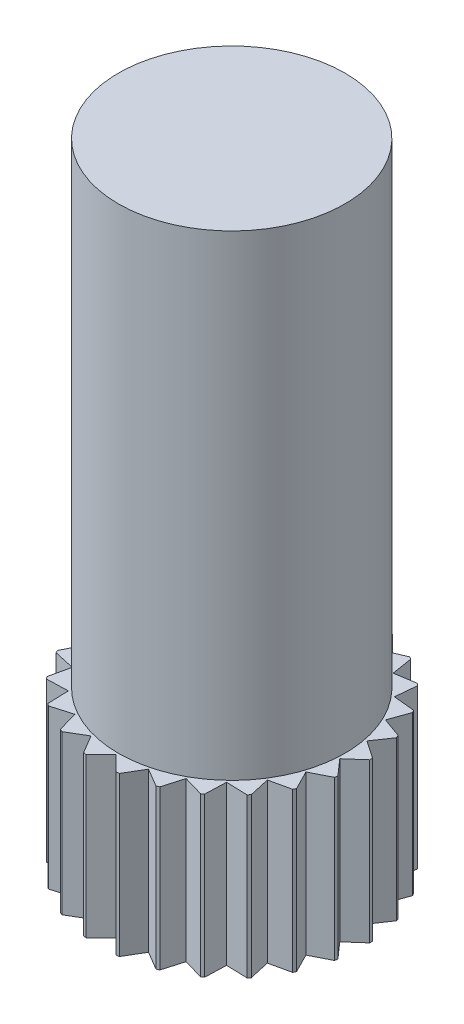
from build123d import *

# Parameters (mm, degrees)
SKETCH_1_R                   = 2.9
EXTRUDE_1_DEPTH              = 3.5
SKETCH_2_R                   = 2.5
EXTRUDE_2_DEPTH              = 10.5
CUT_EXTRUDE_1_DEPTH          = 3.5
HOLE_WIZARD_M3_1_D           = 2.5
HOLE_WIZARD_M3_1_DEPTH       = 8
HOLE_WIZARD_M3_1_CSINK_D     = 3.2
HOLE_WIZARD_M3_1_CSINK_ANGLE = 90
HOLE_WIZARD_M3_1_TIP         = 1.25


with BuildPart() as part:
    # 草图1 → 凸台-拉伸1 (new body)
    with BuildSketch(Plane(origin=(0, 0, 0), x_dir=(1, 0, 0), z_dir=(0, 1, 0))):
        with Locations(Location((0, 0, 0), (0, 0, 270))):
            Circle(SKETCH_1_R)
    extrude(amount=EXTRUDE_1_DEPTH)

    # 草图2 → 凸台-拉伸2 (add)
    with BuildSketch(Plane(origin=(0, 3.5, 0), x_dir=(1, 0, 0), z_dir=(0, 1, 0))):
        with Locations(Location((0, 0, 0), (0, 0, 90))):
            Circle(SKETCH_2_R)
    extrude(amount=EXTRUDE_2_DEPTH)

    # 草图3 → 切除-拉伸1 (cut)
    with BuildSketch(Plane.XZ):
        Polygon((0, 2.55), (0.366495157, 2.916495157), (-0.366495157, 2.916495157), align=None)
        Polygon((0.634159212, 2.469887061), (1.080283889, 2.733724459), (0.370321814, 2.916011738), align=None)
        Polygon((1.228471869, 2.234582034), (1.726194412, 2.3791838), (1.083870103, 2.732304577), align=None)
        Polygon((1.74559512, 1.85887), (2.263641791, 1.875150272), (1.729314848, 2.37691667), align=None)
        Polygon((2.15303621, 1.366358327), (2.658856231, 1.253294157), (2.26610038, 1.872178348), align=None)
        Polygon((2.425194117, 0.787993336), (2.887004956, 0.55268896), (2.660498492, 1.249804175), align=None)
        Polygon((2.544968157, 0.160115825), (2.933752541, -0.182643716), (2.887727699, 0.548900209), align=None)
        Polygon((2.504832489, -0.477822352), (2.796161665, -0.906500217), (2.933510354, -0.186493176), align=None)
        Polygon((2.307308984, -1.085737193), (2.482877668, -1.573397974), (2.794969765, -0.910168509), align=None)
        Polygon((1.964808769, -1.625431174), (2.013585336, -2.141433351), (2.480810946, -1.576654607), align=None)
        Polygon((1.498852393, -2.062993336), (1.417772031, -2.574914594), (2.010773652, -2.144073698), align=None)
        Polygon((0.938717609, -2.370930039), (0.732874896, -2.846604484), (1.414392054, -2.576772752), align=None)
        Polygon((0.319599746, -2.529892488), (0.001928536, -2.939431745), (0.729139002, -2.847563698), align=None)
        Polygon((-0.319599746, -2.529892488), (-0.729139002, -2.847563698), (-0.001928536, -2.939431745), align=None)
        Polygon((-0.938717609, -2.370930039), (-1.414392054, -2.576772752), (-0.732874896, -2.846604484), align=None)
        Polygon((-1.498852393, -2.062993336), (-2.010773652, -2.144073698), (-1.417772031, -2.574914594), align=None)
        Polygon((-1.964808769, -1.625431174), (-2.480810946, -1.576654607), (-2.013585336, -2.141433351), align=None)
        Polygon((-2.307308984, -1.085737193), (-2.794969765, -0.910168509), (-2.482877668, -1.573397974), align=None)
        Polygon((-2.504832489, -0.477822352), (-2.933510354, -0.186493176), (-2.796161665, -0.906500217), align=None)
        Polygon((-2.544968157, 0.160115825), (-2.887727699, 0.548900209), (-2.933752541, -0.182643716), align=None)
        Polygon((-2.425194117, 0.787993336), (-2.660498492, 1.249804175), (-2.887004956, 0.55268896), align=None)
        Polygon((-2.15303621, 1.366358327), (-2.26610038, 1.872178348), (-2.658856231, 1.253294157), align=None)
        Polygon((-1.74559512, 1.85887), (-1.729314848, 2.37691667), (-2.263641791, 1.875150272), align=None)
        Polygon((-1.228471869, 2.234582034), (-1.083870103, 2.732304577), (-1.726194412, 2.3791838), align=None)
        Polygon((-0.634159212, 2.469887061), (-0.370321814, 2.916011738), (-1.080283889, 2.733724459), align=None)
    extrude(amount=-CUT_EXTRUDE_1_DEPTH, mode=Mode.SUBTRACT)

    # M3 螺旋的螺纹孔钻头1
    with Locations(Plane(origin=(0, 0, 0), x_dir=(-1, 0, 0), z_dir=(0, -1, 0))):
        with Locations((0, 0)):
            CounterSinkHole(HOLE_WIZARD_M3_1_D / 2, HOLE_WIZARD_M3_1_CSINK_D / 2, depth=HOLE_WIZARD_M3_1_DEPTH, counter_sink_angle=HOLE_WIZARD_M3_1_CSINK_ANGLE)
            with Locations((0, 0, -(HOLE_WIZARD_M3_1_DEPTH + HOLE_WIZARD_M3_1_TIP / 2))):  # 90° drill point
                Cone(0, HOLE_WIZARD_M3_1_D / 2, HOLE_WIZARD_M3_1_TIP, mode=Mode.SUBTRACT)


solid = part.part
